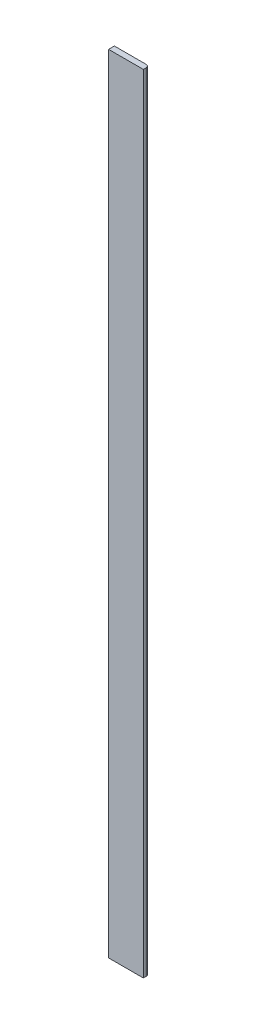
from build123d import *

# Parameters (mm, degrees)
BOSS_EXTRUDE1_DEPTH = 431.8
SKETCH4_W           = 15.875
SKETCH4_H           = 25.4
CUT_EXTRUDE1_DEPTH  = 6.35
SKETCH5_W           = 1.5875
SKETCH5_H           = 25.4
CUT_EXTRUDE2_DEPTH  = 6.35


with BuildPart() as part:
    # Sketch2 → Boss-Extrude1 (new body)
    with BuildSketch(Plane(origin=(0, 0, 0), x_dir=(1, 0, 0), z_dir=(0, 1, 0))):
        with BuildLine():
            Line((0, 0), (19.05, 0))
            Line((19.05, 0), (19.05, 1.5875))
            ThreePointArc((19.05, 1.5875), (18.585032015, 2.710032015), (17.4625, 3.175))
            Line((17.4625, 3.175), (4.7625, 3.175))
            ThreePointArc((4.7625, 3.175), (3.639967985, 3.639967985), (3.175, 4.7625))
            Line((3.175, 4.7625), (3.175, 17.4625))
            ThreePointArc((3.175, 17.4625), (2.710032015, 18.585032015), (1.5875, 19.05))
            Line((1.5875, 19.05), (0, 19.05))
            Line((0, 19.05), (0, 0))
        make_face()
    extrude(amount=BOSS_EXTRUDE1_DEPTH)

    # Sketch4 → Cut-Extrude1 (cut)
    with BuildSketch(Plane(origin=(3.175, 0, 0), x_dir=(0, 0, -1), z_dir=(1, 0, 0))):
        with Locations((11.1125, 419.1)):
            Rectangle(SKETCH4_W, SKETCH4_H)
    extrude(amount=-CUT_EXTRUDE1_DEPTH, mode=Mode.SUBTRACT)

    # Sketch5 → Cut-Extrude2 (cut)
    with BuildSketch(Plane.ZY.offset(-3.175)):
        with Locations((-3.96875, 419.1)):
            Rectangle(SKETCH5_W, SKETCH5_H)
    extrude(amount=-CUT_EXTRUDE2_DEPTH, mode=Mode.SUBTRACT)


solid = part.part
